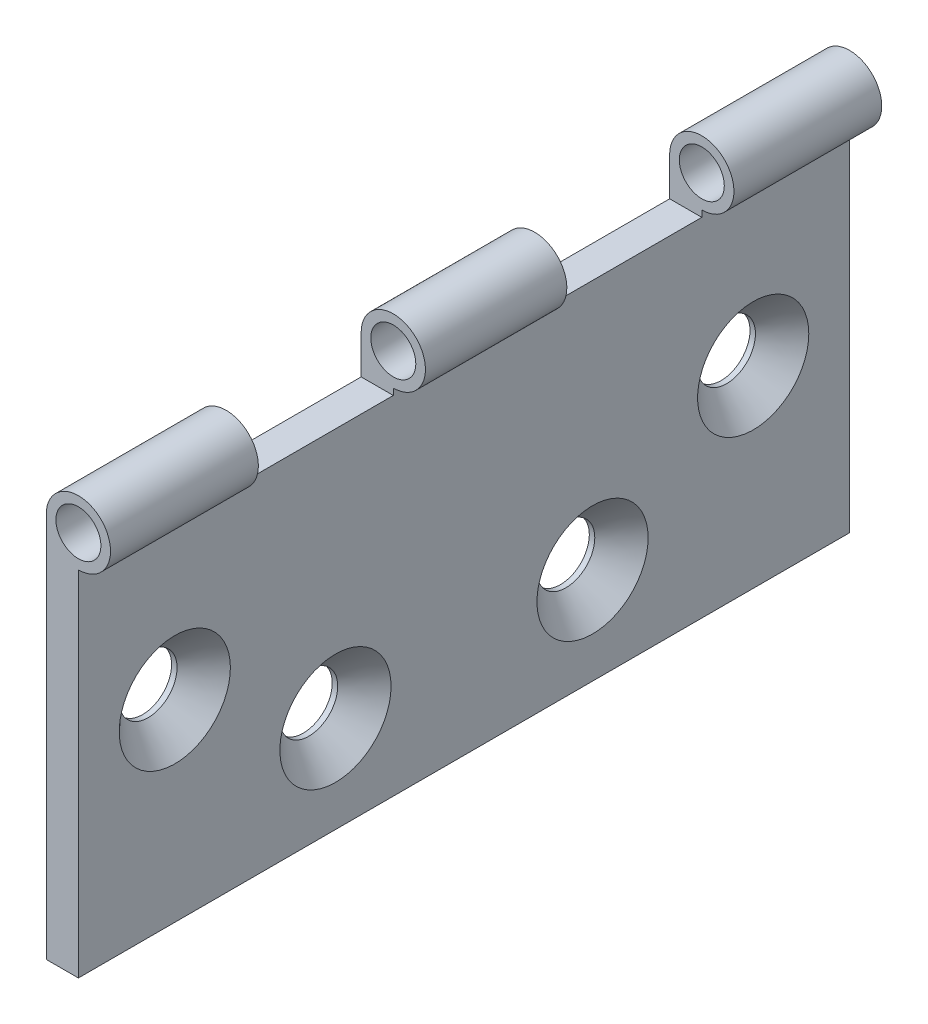
from build123d import *

# Parameters (mm, degrees)
SKETCH_1_W                  = 5
SKETCH_1_H                  = 60
EXTRUDE_1_DEPTH             = 60
SKETCH_2_R                  = 5
SKETCH_3_R                  = 3.5
CUT_EXTRUDE_1_DEPTH         = 137.839321834
HOLE_WIZARD_M8_1_AT_2_COUNT = 2
HOLE_WIZARD_M8_1_AT_2_PITCH = 29.154759474
CUT_EXTRUDE_2143_DEPTH      = 89.600225733
CUT_EXTRUDE_2143_DEPTH_BACK = 89.600225733
SKETCH_11_W                 = 26
SKETCH_11_H                 = 11


with BuildPart() as part:
    # 草图1 → 拉伸-薄壁1 (new, symmetric)
    with BuildSketch(Plane.XY):
        with Locations((2.5, 30)):
            Rectangle(SKETCH_1_W, SKETCH_1_H)
    extrude(amount=EXTRUDE_1_DEPTH, both=True)

    # 扫描1: sweep along a curve in space
    with BuildLine() as sweep_1_path:
        Line((5, 60, 60), (5, 60, -60))
    # 草图2 → 扫描1 (sweep)
    with BuildSketch(Plane.XY.offset(60)):
        with Locations((5, 60)):
            Circle(SKETCH_2_R)
    sweep(path=sweep_1_path.line)

    # 草图3 → 切除-拉伸1 (cut, through all)
    with BuildSketch(Plane.XY.offset(60)):
        with Locations((5, 60)):
            Circle(SKETCH_3_R)
    extrude(amount=-CUT_EXTRUDE_1_DEPTH, mode=Mode.SUBTRACT)

    # 草图5 → M8 平头机械螺钉的锥形沉头孔1 (revolve, cut)
    with BuildSketch(Plane(origin=(5, 30, 45), x_dir=(0, 0, -1), z_dir=(0, 1, 0))):
        Polygon((0, 0), (0, 5), (4.5, 5), (4.5, 4.15), (8.65, 0), align=None)
    hole_wizard_m8_1 = revolve(axis=Axis((11.35, 30, 45), (-1, 0, 0)), mode=Mode.SUBTRACT)

    # M8 平头机械螺钉的锥形沉头孔1 at 2: M8 平头机械螺钉的锥形沉头孔1 ×2
    with Locations(*[Vector(0, -0.5144957554275265, -0.8574929257125442) * (i * HOLE_WIZARD_M8_1_AT_2_PITCH) for i in range(1, HOLE_WIZARD_M8_1_AT_2_COUNT)]):
        add(hole_wizard_m8_1, mode=Mode.SUBTRACT)

    # 镜向1: M8 平头机械螺钉的锥形沉头孔1 across plane
    add(hole_wizard_m8_1.mirror(Plane.XY), mode=Mode.SUBTRACT)

    # 镜向1 copy 1 sketch → 镜向1 copy 1 (revolve, cut)
    with BuildSketch(Plane(origin=(5, 15, -20), x_dir=(0, 0, 1), z_dir=(0, 1, 0))):
        Polygon((0, 0), (0, -5), (4.5, -5), (4.5, -4.15), (8.65, 0), align=None)
    revolve(axis=Axis((11.35, 15, -20), (1, 0, 0)), mode=Mode.SUBTRACT)

    # 草图11 → Cut-Extrude 2143 (cut, two sides: drawn at the far end of the back side and taken through both)
    with BuildSketch(Plane(origin=(5, 0, 0), x_dir=(0, 0, -1), z_dir=(1, 0, 0)).offset(-CUT_EXTRUDE_2143_DEPTH_BACK)):
        with Locations((-24, 59.5)):
            Rectangle(SKETCH_11_W, SKETCH_11_H)
        with Locations((24, 59.5)):
            Rectangle(SKETCH_11_W, SKETCH_11_H)
    extrude(amount=CUT_EXTRUDE_2143_DEPTH + CUT_EXTRUDE_2143_DEPTH_BACK, mode=Mode.SUBTRACT)


solid = part.part
